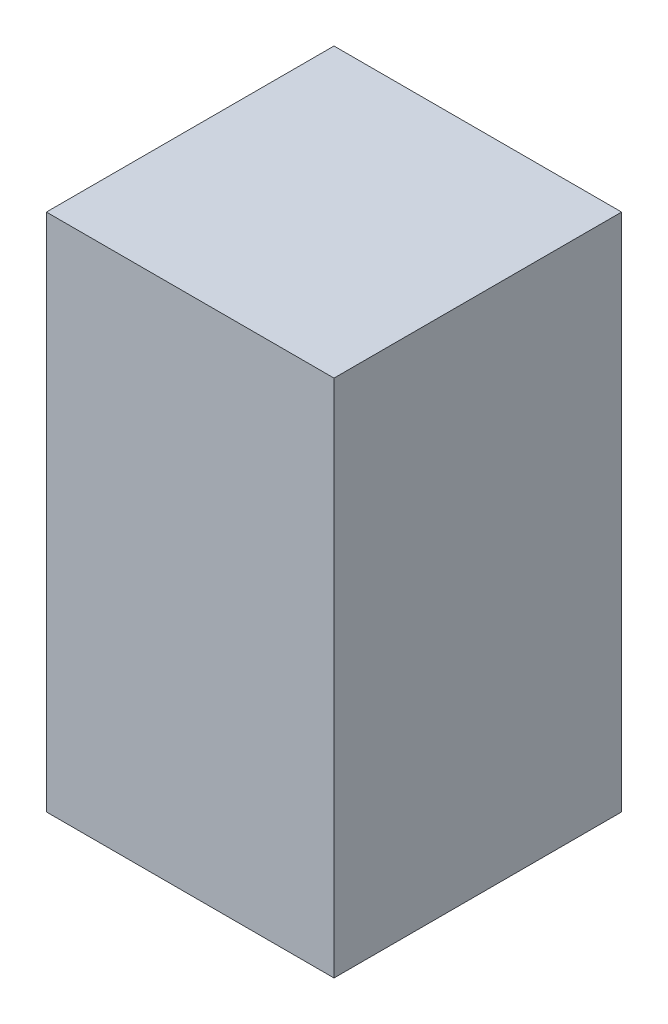
from build123d import *

# Parameters (mm, degrees)
CROQUIS1_W              = 620
CROQUIS1_H              = 1120
CROQUIS1_W_2            = 600
CROQUIS1_H_2            = 1100
SALIENTE_EXTRUIR1_DEPTH = 600
CROQUIS6_W              = 620
CROQUIS6_H              = 1120
SALIENTE_EXTRUIR4_DEPTH = 20


with BuildPart() as part:
    # Croquis1 → Saliente-Extruir1 (new body)
    with BuildSketch(Plane.XY):
        with Locations((300, -550)):
            Rectangle(CROQUIS1_W, CROQUIS1_H)
        with Locations((300, -550)):
            Rectangle(CROQUIS1_W_2, CROQUIS1_H_2, mode=Mode.SUBTRACT)
    extrude(amount=SALIENTE_EXTRUIR1_DEPTH)

    # Croquis6 → Saliente-Extruir4 (add)
    with BuildSketch(Plane.XY.offset(600)):
        with Locations((300, -550)):
            Rectangle(CROQUIS6_W, CROQUIS6_H)
    extrude(amount=SALIENTE_EXTRUIR4_DEPTH)


solid = part.part
